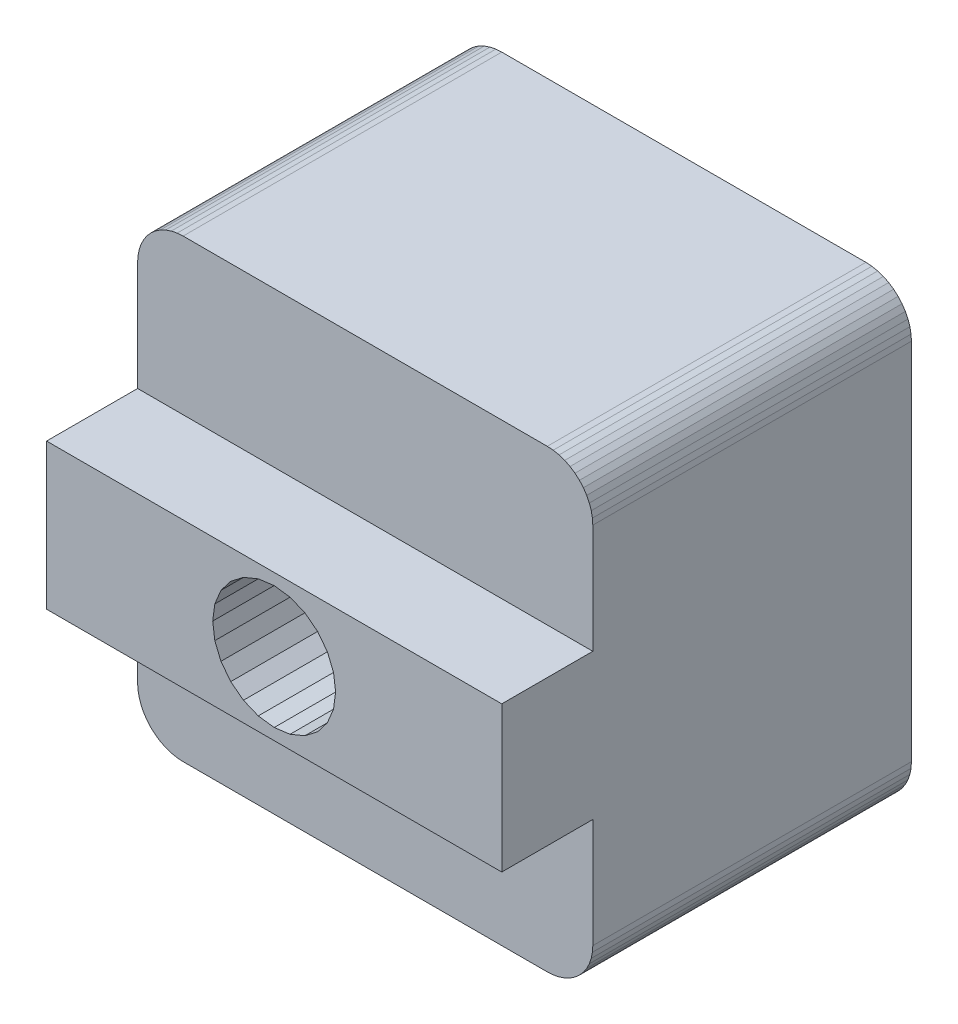
from build123d import *

# Parameters (mm, degrees)
BOSS_EXTRUDE1_DEPTH = 7
SKETCH2_W           = 9.999992371
SKETCH2_H           = 3.199996948
BOSS_EXTRUDE2_DEPTH = 2
CUT_EXTRUDE1_DEPTH  = 117.710110959


with BuildPart() as part:
    # Sketch1 → Boss-Extrude1 (new body)
    with BuildSketch(Plane.XY.offset(7)):
        Polygon((84.366027832, 79.5), (84.293357849, 79.608764648), (84.207107544, 79.707107544), (84.108764648, 79.79335022), (84, 79.866027832), (83.88269043, 79.923881531), (83.75881958, 79.965927124), (83.630531311, 79.991447449), (83.5, 80), (75.500007629, 80), (75.369476318, 79.991447449), (75.241188049, 79.965927124), (75.1173172, 79.923881531), (75.000007629, 79.866027832), (74.891242981, 79.79335022), (74.792900085, 79.707107544), (74.70664978, 79.608764648), (74.633979797, 79.5), (74.576126099, 79.3826828), (74.534080505, 79.25881958), (74.508560181, 79.130523682), (74.500007629, 79), (74.500007629, 71), (74.508560181, 70.869476318), (74.534080505, 70.74118042), (74.576126099, 70.6173172), (74.633979797, 70.5), (74.70664978, 70.391235352), (74.792900085, 70.292892456), (74.891242981, 70.20664978), (75.000007629, 70.133972168), (75.1173172, 70.076118469), (75.241188049, 70.034072876), (75.369476318, 70.008552551), (75.500007629, 70), (83.5, 70), (83.630531311, 70.008552551), (83.75881958, 70.034072876), (83.88269043, 70.076118469), (84, 70.133972168), (84.108764648, 70.20664978), (84.207107544, 70.292892456), (84.293357849, 70.391235352), (84.366027832, 70.5), (84.423881531, 70.6173172), (84.465927124, 70.74118042), (84.491447449, 70.869476318), (84.5, 71), (84.5, 79), (84.491447449, 79.130523682), (84.465927124, 79.25881958), (84.423881531, 79.3826828), align=None)
    extrude(amount=-BOSS_EXTRUDE1_DEPTH)

    # Sketch2 → Boss-Extrude2 (add)
    with BuildSketch(Plane.XY.offset(7)):
        with Locations((79.500003815, 75)):
            Rectangle(SKETCH2_W, SKETCH2_H)
    extrude(amount=BOSS_EXTRUDE2_DEPTH)

    # Sketch3 → Cut-Extrude1 (cut, through all)
    with BuildSketch(Plane(origin=(0, 0, 0), x_dir=(-1, 0, 0), z_dir=(0, 0, -1))):
        Polygon((-80.454597473, 75.954597473), (-80.669136047, 75.675003052), (-80.804000854, 75.349403381), (-80.850006104, 75), (-80.804000854, 74.650596619), (-80.669136047, 74.324996948), (-80.454597473, 74.045402527), (-80.175003052, 73.830863953), (-79.849411011, 73.695999146), (-79.500007629, 73.650001526), (-79.150596619, 73.695999146), (-78.825004578, 73.830863953), (-78.545410156, 74.045402527), (-78.330871582, 74.324996948), (-78.196006775, 74.650596619), (-78.150001526, 75), (-78.196006775, 75.349403381), (-78.330871582, 75.675003052), (-78.545410156, 75.954597473), (-78.825004578, 76.169136047), (-79.150596619, 76.304000854), (-79.500007629, 76.349998474), (-79.849411011, 76.304000854), (-80.175003052, 76.169136047), align=None)
    extrude(amount=-CUT_EXTRUDE1_DEPTH, mode=Mode.SUBTRACT)


solid = part.part
